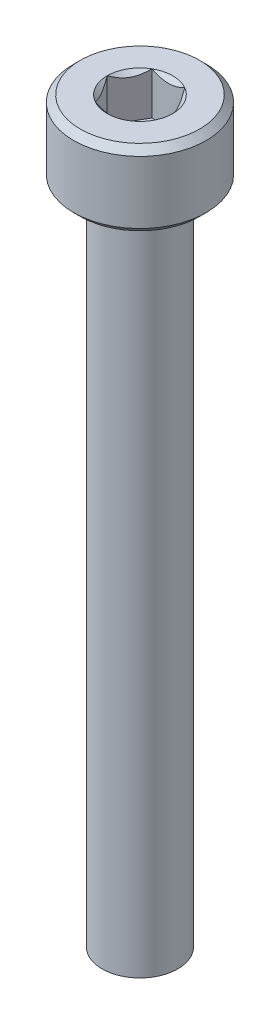
from build123d import *

# Parameters (mm, degrees)
SKETCH1_R           = 3.5
BOSS_EXTRUDE1_DEPTH = 4
CUT_EXTRUDE1_DEPTH  = 2.25
CHAMFER1_SIZE       = 0.35
SKETCH_1_R          = 2
EXTRUDE_1_DEPTH     = 35


with BuildPart() as part:
    # Sketch1 → Boss-Extrude1 (new body)
    with BuildSketch(Plane(origin=(0, 0, 0), x_dir=(1, 0, 0), z_dir=(0, 1, 0))):
        with Locations(Location((0, 0, 0), (0, 0, 270))):
            Circle(SKETCH1_R)
    extrude(amount=BOSS_EXTRUDE1_DEPTH)

    # Sketch2 → Cut-Extrude1 (cut)
    with BuildSketch(Plane(origin=(0, 4, 0), x_dir=(1, 0, 0), z_dir=(0, 1, 0))):
        Polygon((0.866025404, 1.5), (-0.866025404, 1.5), (-1.732050808, 0), (-0.866025404, -1.5), (0.866025404, -1.5), (1.732050808, 0), align=None)
    extrude(amount=-CUT_EXTRUDE1_DEPTH, mode=Mode.SUBTRACT)

    # Cut-Extrude2 cone 1 section (through the dimple's axis) → Cut-Extrude2 (revolve, cut)
    with BuildSketch(Plane(origin=(0, 4, 0), x_dir=(0, 0, 1), z_dir=(1, 0, 0))):
        Polygon((0, 0), (1.732050808, 0), (0, 1.732050808), align=None)
    revolve(axis=Axis((0, 4, 0), (0, -1, 0)), mode=Mode.SUBTRACT)

    # Chamfer1
    chamfer1_edges = [part.edges().sort_by_distance(p)[0] for p in [
        (0, 0, -3.5),
        (0, 4, -3.5),
    ]]
    chamfer(chamfer1_edges, length=CHAMFER1_SIZE)

    # 草图1 → 凸台-拉伸1 (add)
    with BuildSketch(Plane(origin=(0, 0, 0), x_dir=(-1, 0, 0), z_dir=(0, -1, 0))):
        with Locations(Location((0, 0, 0), (0, 0, 90))):
            Circle(SKETCH_1_R)
    extrude(amount=EXTRUDE_1_DEPTH)


solid = part.part
